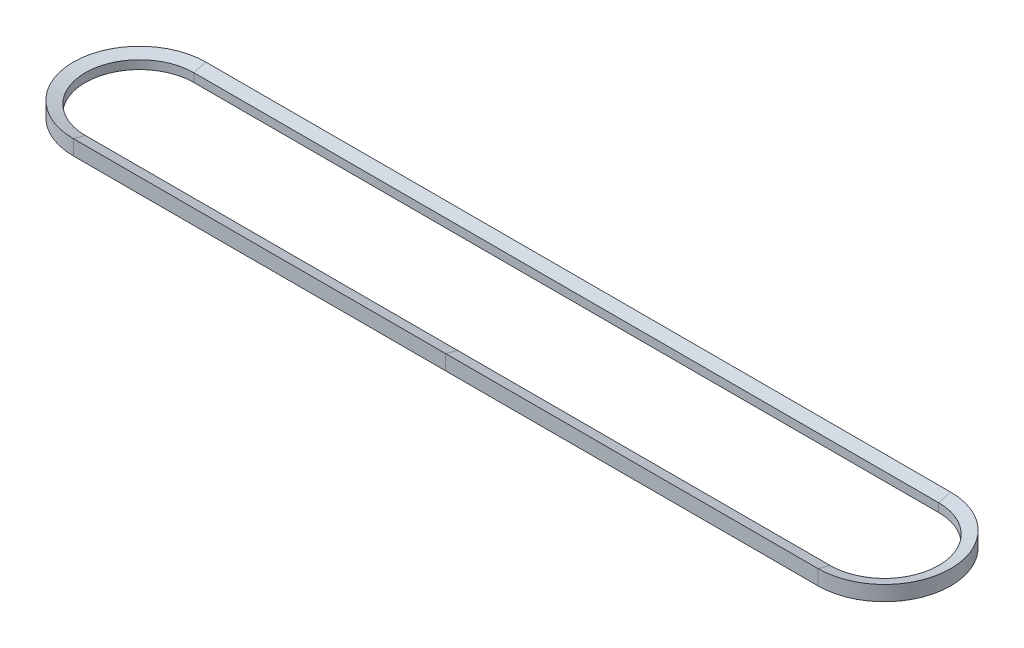
from build123d import *


with BuildPart() as part:
    # Sweep1: sweep along a path in Sketch1
    with BuildLine(Plane(origin=(0, 0, 0), x_dir=(1, 0, 0), z_dir=(0, 1, 0))) as sweep1_path:
        Line((-217.695, 31.75), (217.695, 31.75))
        ThreePointArc((217.695, 31.75), (249.445, 0), (217.695, -31.75))
        Line((217.695, -31.75), (-217.695, -31.75))
        ThreePointArc((-217.695, -31.75), (-249.445, 0), (-217.695, 31.75))
    # Sketch2 → Sweep1 (sweep)
    with BuildSketch(Plane(origin=(0, 0, 0), x_dir=(0, 0, -1), z_dir=(1, 0, 0))):
        Polygon((-38.75, 4.375644347), (-31.75, 2.5), (-31.75, -2.5), (-38.75, -4.375644347), align=None)
    sweep(path=sweep1_path.line)


solid = part.part
